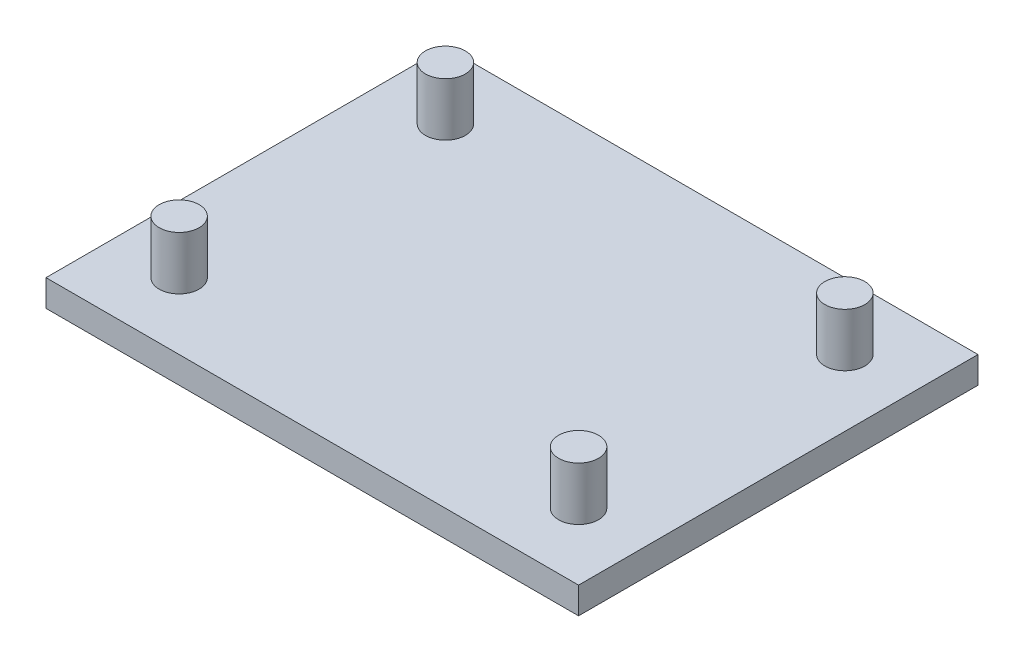
from build123d import *

# Parameters (mm, degrees)
SKETCH1_W           = 200
SKETCH1_H           = 150
BOSS_EXTRUDE1_DEPTH = 10
SKETCH2_R           = 7.5
BOSS_EXTRUDE2_DEPTH = 20


with BuildPart() as part:
    # Sketch1 → Boss-Extrude1 (new body)
    with BuildSketch(Plane(origin=(0, 0, 0), x_dir=(1, 0, 0), z_dir=(0, 1, 0))):
        Rectangle(SKETCH1_W, SKETCH1_H)
    extrude(amount=BOSS_EXTRUDE1_DEPTH)

    # Sketch2 → Boss-Extrude2 (add)
    with BuildSketch(Plane(origin=(0, 10, 0), x_dir=(1, 0, 0), z_dir=(0, 1, 0))):
        with Locations(Location((75, 50, 0), (0, 0, 90))):
            Circle(SKETCH2_R)
        with Locations(Location((75, -50, 0), (0, 0, 90))):
            Circle(SKETCH2_R)
        with Locations(Location((-75, -50, 0), (0, 0, 90))):
            Circle(SKETCH2_R)
        with Locations(Location((-75, 50, 0), (0, 0, 90))):
            Circle(SKETCH2_R)
    extrude(amount=BOSS_EXTRUDE2_DEPTH)


solid = part.part
